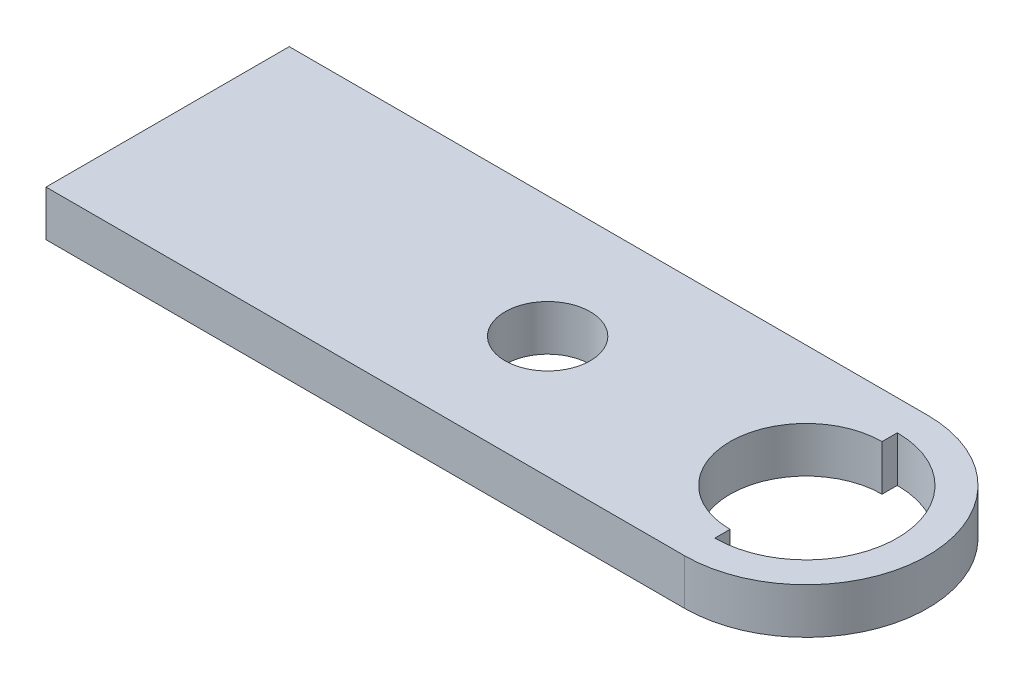
from build123d import *

# Parameters (mm, degrees)
BOSS_EXTRUDE1_DEPTH          = 15
TAP_DRILL_FOR_M30X2_0_TAP1_D = 28


with BuildPart() as part:
    # Sketch1 → Boss-Extrude1 (new body)
    with BuildSketch(Plane(origin=(0, 0, 0), x_dir=(1, 0, 0), z_dir=(0, 1, 0))):
        with BuildLine():
            Line((-114.776877535, 40), (95.223122465, 40))
            ThreePointArc((95.223122465, 40), (135.223122465, 0), (95.223122465, -40))
            Line((95.223122465, -40), (-114.776877535, -40))
            Line((-114.776877535, -40), (-114.776877535, 40))
        make_face()
        with BuildLine():
            Line((95.223122465, 30), (95.223122465, 25))
            ThreePointArc((95.223122465, 25), (70.223122465, 0), (95.223122465, -25))
            Line((95.223122465, -25), (95.223122465, -30))
            ThreePointArc((95.223122465, -30), (125.223122465, 0), (95.223122465, 30))
        make_face(mode=Mode.SUBTRACT)
    extrude(amount=BOSS_EXTRUDE1_DEPTH)

    # Tap Drill for M30x2.0 Tap1 (through all)
    with Locations(Plane(origin=(0, 15, 0), x_dir=(1, 0, 0), z_dir=(0, 1, 0))):
        with Locations((10.223122465, 0)):
            Hole(TAP_DRILL_FOR_M30X2_0_TAP1_D / 2)


solid = part.part
